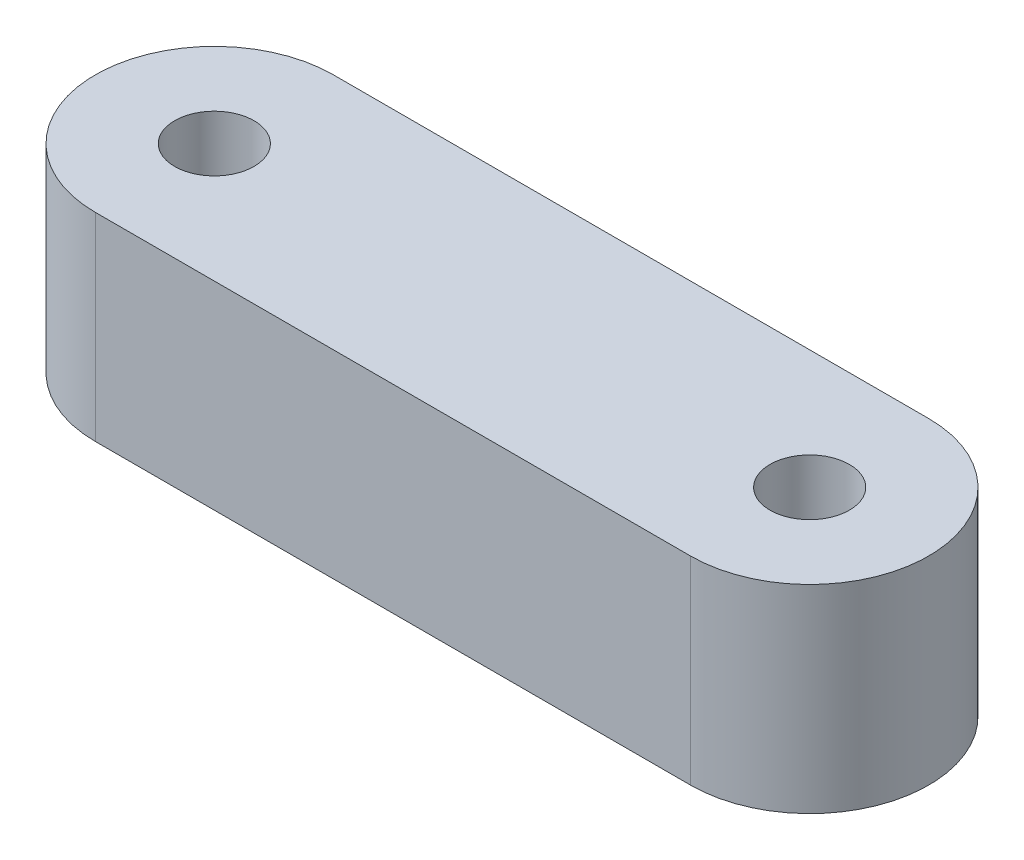
from build123d import *

# Parameters (mm, degrees)
BOSS_EXTRUDE1_DEPTH = 12.7
SKETCH4_R           = 2.54
CUT_EXTRUDE3_DEPTH  = 73.645776202


with BuildPart() as part:
    # Sketch3 → Boss-Extrude1 (new body)
    with BuildSketch(Plane(origin=(0, 0, 0), x_dir=(1, 0, 0), z_dir=(0, 1, 0))):
        with BuildLine():
            Line((-63.5, 7.62), (-25.4, 7.62))
            ThreePointArc((-25.4, 7.62), (-17.78, 0), (-25.4, -7.62))
            Line((-25.4, -7.62), (-63.5, -7.62))
            ThreePointArc((-63.5, -7.62), (-71.12, 0), (-63.5, 7.62))
        make_face()
    extrude(amount=BOSS_EXTRUDE1_DEPTH)

    # Sketch4 → Cut-Extrude3 (cut, through all)
    with BuildSketch(Plane(origin=(0, 12.7, 0), x_dir=(1, 0, 0), z_dir=(0, 1, 0))):
        with Locations(Location((-63.5, 0, 0), (0, 0, 270))):
            Circle(SKETCH4_R)
        with Locations(Location((-25.4, 0, 0), (0, 0, 90))):
            Circle(SKETCH4_R)
    extrude(amount=-CUT_EXTRUDE3_DEPTH, mode=Mode.SUBTRACT)


solid = part.part
